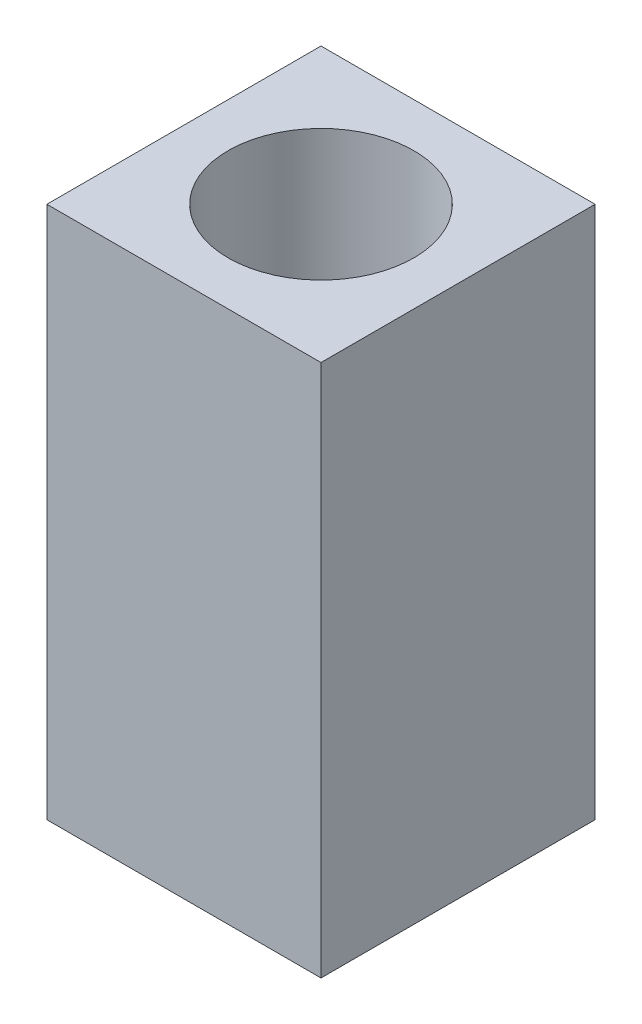
from build123d import *

# Parameters (mm, degrees)
SKETCH1_W           = 18
SKETCH1_H           = 18
SKETCH1_R           = 6.1
BOSS_EXTRUDE1_DEPTH = 35


with BuildPart() as part:
    # Sketch1 → Boss-Extrude1 (new body)
    with BuildSketch(Plane(origin=(0, 0, 0), x_dir=(1, 0, 0), z_dir=(0, 1, 0))):
        with Locations((9, 9)):
            Rectangle(SKETCH1_W, SKETCH1_H)
        with Locations(Location((9, 9, 0), (0, 0, 270))):
            Circle(SKETCH1_R, mode=Mode.SUBTRACT)
    extrude(amount=BOSS_EXTRUDE1_DEPTH)


solid = part.part
